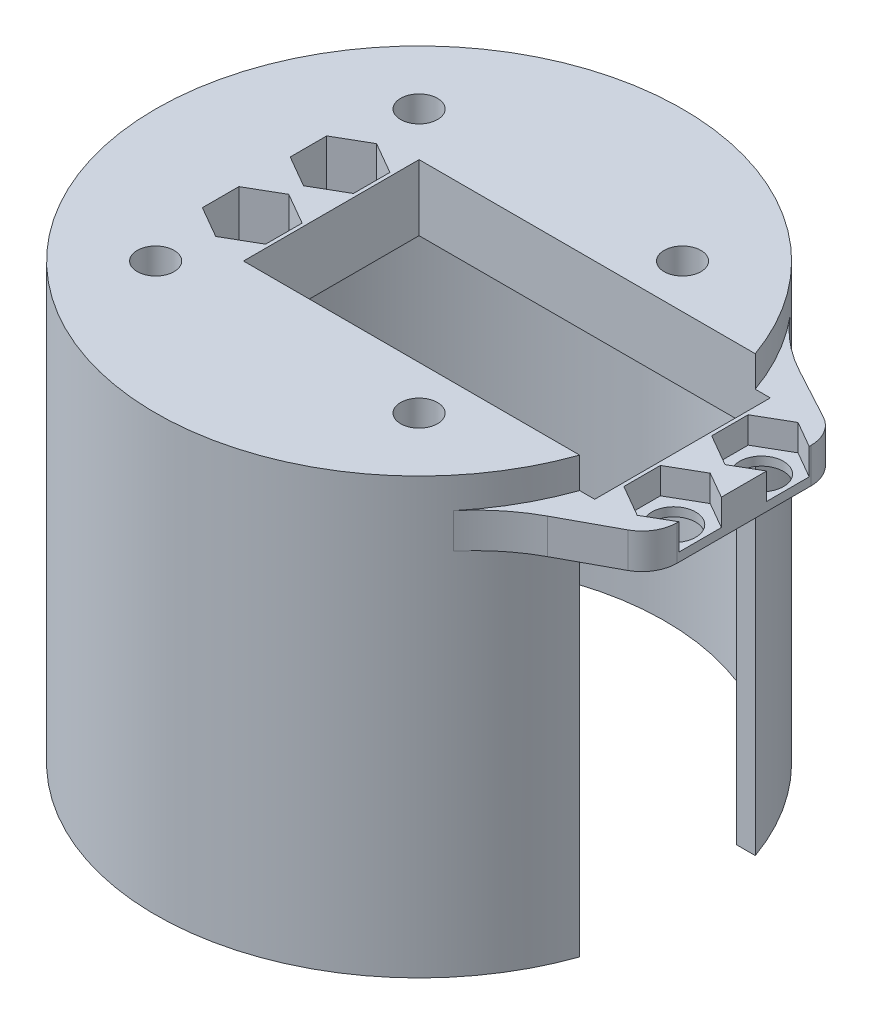
from build123d import *

# Parameters (mm, degrees)
SKETCH_1_R          = 2.5
SKETCH_1_W          = 40
SKETCH_1_H          = 20
EXTRUDE_3_DEPTH     = 4
EXTRUDE_START       = 42
EXTRUDE_16_DEPTH    = 42
CUT_EXTRUDE_1_DEPTH = 3
EXTRUDE_4_DEPTH     = 3.5
CUT_EXTRUDE_2_DEPTH = 3
SKETCH_6_R          = 2.1
CUT_EXTRUDE_3_DEPTH = 66.299310869


with BuildPart() as part:
    # 草图1 → 凸台-拉伸3 (new body)
    with BuildSketch(Plane(origin=(0, 0, 0), x_dir=(1, 0, 0), z_dir=(0, 1, 0))):
        with BuildLine():
            Line((18.956802834, 14.347674144), (24.902068137, 11.134017223))
            ThreePointArc((24.902068137, 11.134017223), (26.435714813, 9.663571926), (27, 7.615191169))
            Line((27, 7.615191169), (27, -7.615191169))
            ThreePointArc((27, -7.615191169), (26.435714813, -9.663571926), (24.902068137, -11.134017223))
            Line((24.902068137, -11.134017223), (18.956802834, -14.347674144))
            ThreePointArc((18.956802834, -14.347674144), (15.787653215, -16.474725649), (13.080286113, -19.165082649))
            ThreePointArc((13.080286113, -19.165082649), (-40, 0), (13.080286113, 19.165082649))
            ThreePointArc((13.080286113, 19.165082649), (15.787653215, 16.474725649), (18.956802834, 14.347674144))
        make_face()
        with Locations(Location((24, 5, 0), (0, 0, 270))):
            Circle(SKETCH_1_R, mode=Mode.SUBTRACT)
        with Locations(Location((24, -5, 0), (0, 0, 270))):
            Circle(SKETCH_1_R, mode=Mode.SUBTRACT)
        with Locations(Location((-24, 5, 0), (0, 0, 270))):
            Circle(SKETCH_1_R, mode=Mode.SUBTRACT)
        with Locations(Location((-24, -5, 0), (0, 0, 270))):
            Circle(SKETCH_1_R, mode=Mode.SUBTRACT)
        Rectangle(SKETCH_1_W, SKETCH_1_H, mode=Mode.SUBTRACT)
    extrude(amount=EXTRUDE_3_DEPTH)

    # 草图10 → 凸台-拉伸16 (add)
    with BuildSketch(Plane.XZ.offset(EXTRUDE_START)):
        with BuildLine():
            Line((16.153393661, 10), (18.284271247, 10))
            ThreePointArc((18.284271247, 10), (16.087911438, 14.812861871), (13.080286113, 19.165082649))
            ThreePointArc((13.080286113, 19.165082649), (-40, 0), (13.080286113, -19.165082649))
            ThreePointArc((13.080286113, -19.165082649), (16.087911438, -14.812861871), (18.284271247, -10))
            Line((18.284271247, -10), (16.153393661, -10))
            ThreePointArc((16.153393661, -10), (-38, 0), (16.153393661, 10))
        make_face()
    extrude(amount=-EXTRUDE_16_DEPTH)

    # 草图2 → 切除-拉伸1 (cut)
    with BuildSketch(Plane(origin=(0, 4, 0), x_dir=(1, 0, 0), z_dir=(0, 1, 0))):
        Polygon((24, 0.843078062), (27.6, 2.921539031), (27.6, 7.078460969), (24, 9.156921938), (20.4, 7.078460969), (20.4, 2.921539031), align=None)
        Polygon((-24, 0.843078062), (-20.4, 2.921539031), (-20.4, 7.078460969), (-24, 9.156921938), (-27.6, 7.078460969), (-27.6, 2.921539031), align=None)
        Polygon((24, -9.156921938), (27.6, -7.078460969), (27.6, -2.921539031), (24, -0.843078062), (20.4, -2.921539031), (20.4, -7.078460969), align=None)
        Polygon((-24, -9.156921938), (-20.4, -7.078460969), (-20.4, -2.921539031), (-24, -0.843078062), (-27.6, -2.921539031), (-27.6, -7.078460969), align=None)
    extrude(amount=-CUT_EXTRUDE_1_DEPTH, mode=Mode.SUBTRACT)

    # 草图3 → 凸台-拉伸4 (add)
    with BuildSketch(Plane(origin=(0, 4, 0), x_dir=(1, 0, 0), z_dir=(0, 1, 0))):
        with BuildLine():
            Line((18.284271247, -10), (-20, -10))
            Line((-20, -10), (-20, 10))
            Line((-20, 10), (18.284271247, 10))
            ThreePointArc((18.284271247, 10), (16.087911438, 14.812861871), (13.080286113, 19.165082649))
            ThreePointArc((13.080286113, 19.165082649), (-40, 0), (13.080286113, -19.165082649))
            ThreePointArc((13.080286113, -19.165082649), (16.087911438, -14.812861871), (18.284271247, -10))
        make_face()
        Polygon((-20.4, -7.078460969), (-24, -9.156921938), (-27.6, -7.078460969), (-27.6, -2.921539031), (-24, -0.843078062), (-20.4, -2.921539031), align=None, mode=Mode.SUBTRACT)
        Polygon((-20.4, 2.921539031), (-24, 0.843078062), (-27.6, 2.921539031), (-27.6, 7.078460969), (-24, 9.156921938), (-20.4, 7.078460969), align=None, mode=Mode.SUBTRACT)
    extrude(amount=EXTRUDE_4_DEPTH)

    # 草图4 → 切除-拉伸2 (cut)
    with BuildSketch(Plane.XZ):
        Polygon((9.156921938, 15), (7.078460969, 18.6), (2.921539031, 18.6), (0.843078062, 15), (2.921539031, 11.4), (7.078460969, 11.4), align=None)
        Polygon((-20.843078062, 15), (-22.921539031, 18.6), (-27.078460969, 18.6), (-29.156921938, 15), (-27.078460969, 11.4), (-22.921539031, 11.4), align=None)
        Polygon((9.156921938, -15), (7.078460969, -11.4), (2.921539031, -11.4), (0.843078062, -15), (2.921539031, -18.6), (7.078460969, -18.6), align=None)
        Polygon((-20.843078062, -15), (-22.921539031, -11.4), (-27.078460969, -11.4), (-29.156921938, -15), (-27.078460969, -18.6), (-22.921539031, -18.6), align=None)
    extrude(amount=-CUT_EXTRUDE_2_DEPTH, mode=Mode.SUBTRACT)

    # 草图6 → 切除-拉伸3 (cut, through all)
    with BuildSketch(Plane.XZ):
        with Locations(Location((-25, 15, 0), (0, 0, 270))):
            Circle(SKETCH_6_R)
        with Locations(Location((5, 15, 0), (0, 0, 270))):
            Circle(SKETCH_6_R)
        with Locations(Location((5, -15, 0), (0, 0, 270))):
            Circle(SKETCH_6_R)
        with Locations(Location((-25, -15, 0), (0, 0, 270))):
            Circle(SKETCH_6_R)
    extrude(amount=-CUT_EXTRUDE_3_DEPTH, mode=Mode.SUBTRACT)


solid = part.part
